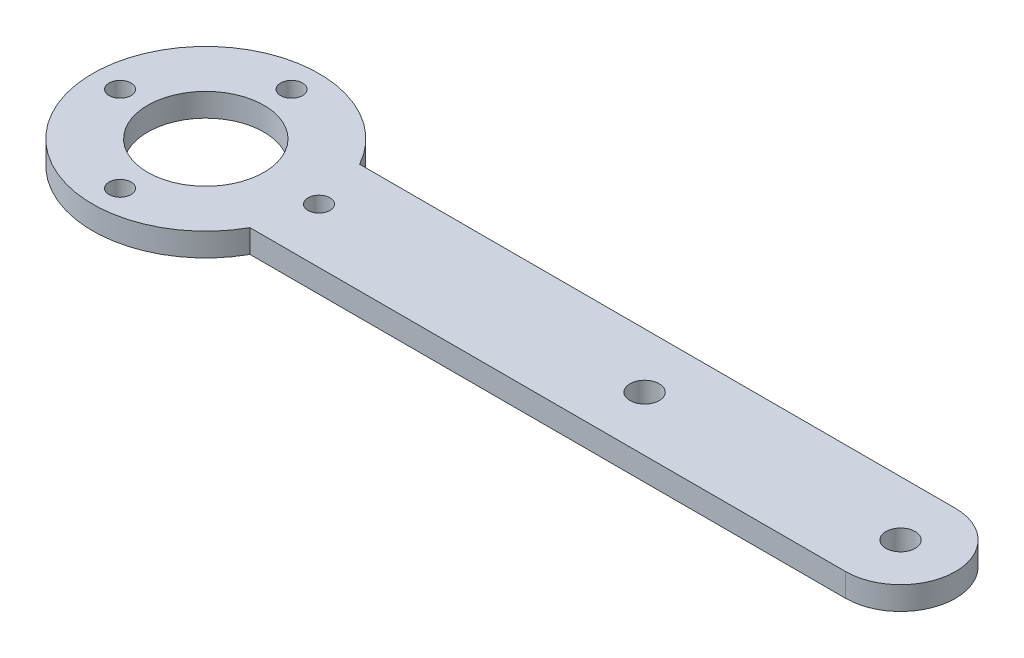
from build123d import *

# Parameters (mm, degrees)
SKETCH1_R           = 7.95
SKETCH1_R_2         = 1.5
SKETCH1_R_3         = 2
BOSS_EXTRUDE1_DEPTH = 3.175


with BuildPart() as part:
    # Sketch1 → Boss-Extrude1 (new body)
    with BuildSketch(Plane(origin=(0, 0, 0), x_dir=(1, 0, 0), z_dir=(0, 1, 0))):
        with BuildLine():
            Line((13.53608603, 7.5), (95, 7.5))
            ThreePointArc((95, 7.5), (102.5, 0), (95, -7.5))
            Line((95, -7.5), (13.53608603, -7.5))
            ThreePointArc((13.53608603, -7.5), (-15.475, 0), (13.53608603, 7.5))
        make_face()
        with Locations(Location((0, 0, 0), (0, 0, 270))):
            Circle(SKETCH1_R, mode=Mode.SUBTRACT)
        with Locations(Location((0, -11.725, 0), (0, 0, 270))):
            Circle(SKETCH1_R_2, mode=Mode.SUBTRACT)
        with Locations(Location((0, 11.725, 0), (0, 0, 270))):
            Circle(SKETCH1_R_2, mode=Mode.SUBTRACT)
        with Locations(Location((-11.725, 0, 0), (0, 0, 270))):
            Circle(SKETCH1_R_2, mode=Mode.SUBTRACT)
        with Locations(Location((15.475, 0, 0), (0, 0, 270))):
            Circle(SKETCH1_R_2, mode=Mode.SUBTRACT)
        with Locations(Location((95, 0, 0), (0, 0, 270))):
            Circle(SKETCH1_R_3, mode=Mode.SUBTRACT)
        with Locations(Location((60, 0, 0), (0, 0, 270))):
            Circle(SKETCH1_R_3, mode=Mode.SUBTRACT)
    extrude(amount=BOSS_EXTRUDE1_DEPTH)


solid = part.part
